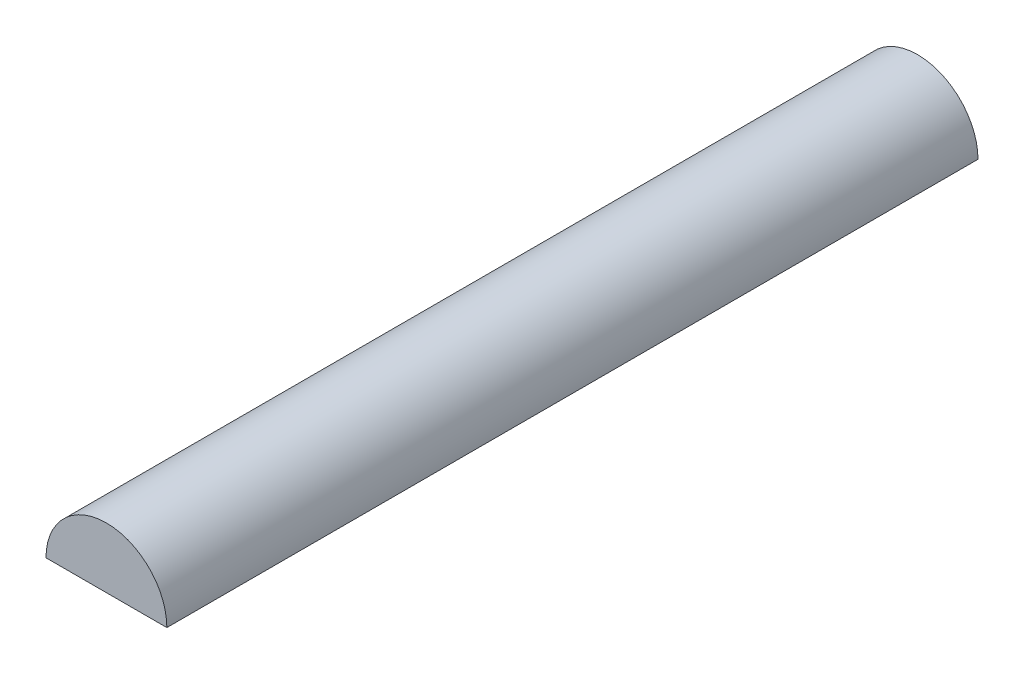
from build123d import *

# Parameters (mm, degrees)
EXTRUDE1_DEPTH = 10


with BuildPart() as part:
    # Sketch1 → Extrude1 (new body)
    with BuildSketch(Plane.XY):
        with BuildLine():
            Line((-0.745, 0), (0.745, 0))
            ThreePointArc((0.745, 0), (0, 0.745), (-0.745, 0))
        make_face()
    extrude(amount=EXTRUDE1_DEPTH)


solid = part.part
